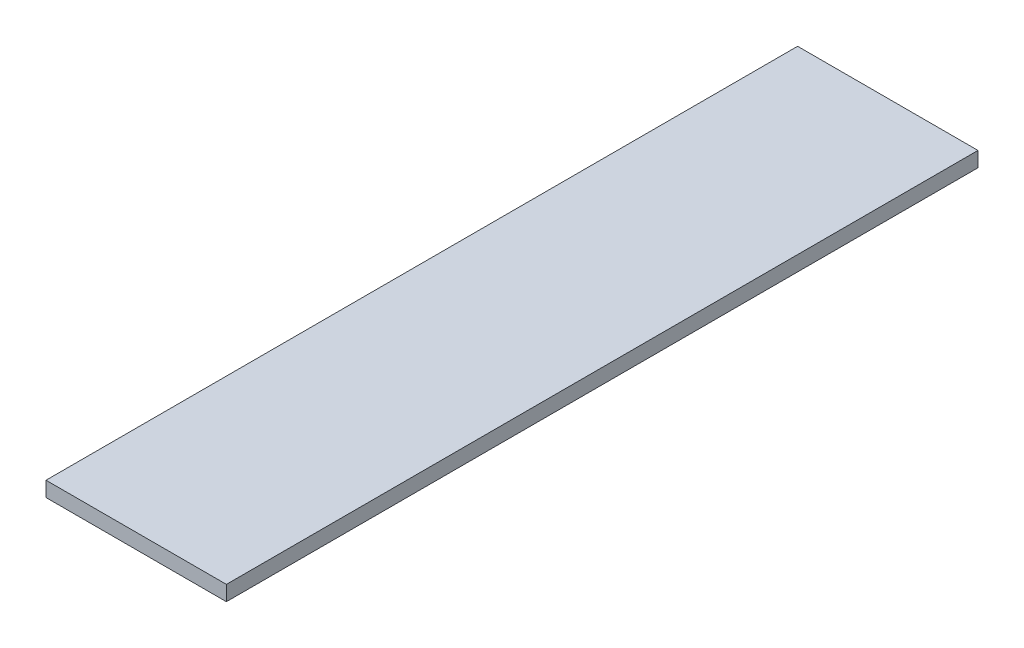
from build123d import *

# Parameters (mm, degrees)
SKETCH1_W           = 120
SKETCH1_H           = 10
BOSS_EXTRUDE1_DEPTH = 500


with BuildPart() as part:
    # Sketch1 → Boss-Extrude1 (new body)
    with BuildSketch(Plane.XY):
        with Locations((60, -5)):
            Rectangle(SKETCH1_W, SKETCH1_H)
    extrude(amount=BOSS_EXTRUDE1_DEPTH)


solid = part.part
